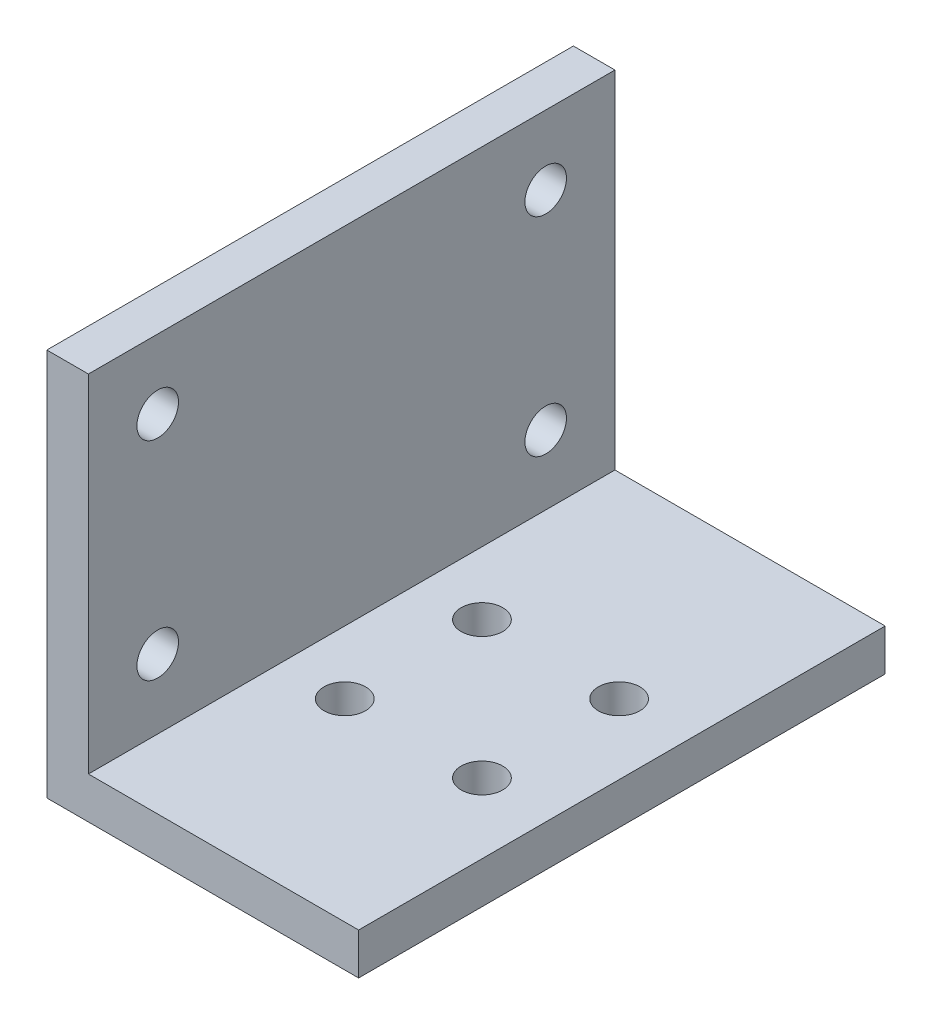
from build123d import *

# Parameters (mm, degrees)
SKETCH_1_W          = 22.5
SKETCH_1_H          = 38
EXTRUDE_1_DEPTH     = 3
SKETCH_2_W          = 3
SKETCH_2_H          = 38
EXTRUDE_2_DEPTH     = 25
SKETCH_3_R          = 1.5
CUT_EXTRUDE_2_DEPTH = 25
SKETCH_4_R          = 1.5
CUT_EXTRUDE_3_DEPTH = 25


with BuildPart() as part:
    # 草图1 → 凸台-拉伸1 (new body)
    with BuildSketch(Plane(origin=(0, 0, 0), x_dir=(1, 0, 0), z_dir=(0, 1, 0))):
        Rectangle(SKETCH_1_W, SKETCH_1_H)
    extrude(amount=EXTRUDE_1_DEPTH)

    # 草图2 → 凸台-拉伸2 (add)
    with BuildSketch(Plane(origin=(0, 3, 0), x_dir=(1, 0, 0), z_dir=(0, 1, 0))):
        with Locations((-9.75, 0)):
            Rectangle(SKETCH_2_W, SKETCH_2_H)
    extrude(amount=EXTRUDE_2_DEPTH)

    # 草图3 → 切除-拉伸2 (cut)
    with BuildSketch(Plane.XZ):
        with Locations(Location((-3.699747468, 5.049747468, 0), (0, 0, 270))):
            Circle(SKETCH_3_R)
        with Locations(Location((6.199747468, 5.049747468, 0), (0, 0, 270))):
            Circle(SKETCH_3_R)
        with Locations(Location((-3.699747468, -4.849747468, 0), (0, 0, 270))):
            Circle(SKETCH_3_R)
        with Locations(Location((6.199747468, -4.849747468, 0), (0, 0, 270))):
            Circle(SKETCH_3_R)
    extrude(amount=-CUT_EXTRUDE_2_DEPTH, mode=Mode.SUBTRACT)

    # 草图4 → 切除-拉伸3 (cut)
    with BuildSketch(Plane(origin=(-8.25, 0, 0), x_dir=(0, 0, -1), z_dir=(1, 0, 0))):
        with Locations((14, 23)):
            Circle(SKETCH_4_R)
        with Locations((-14, 23)):
            Circle(SKETCH_4_R)
        with Locations((-14, 8)):
            Circle(SKETCH_4_R)
        with Locations((14, 8)):
            Circle(SKETCH_4_R)
    extrude(amount=-CUT_EXTRUDE_3_DEPTH, mode=Mode.SUBTRACT)


solid = part.part
